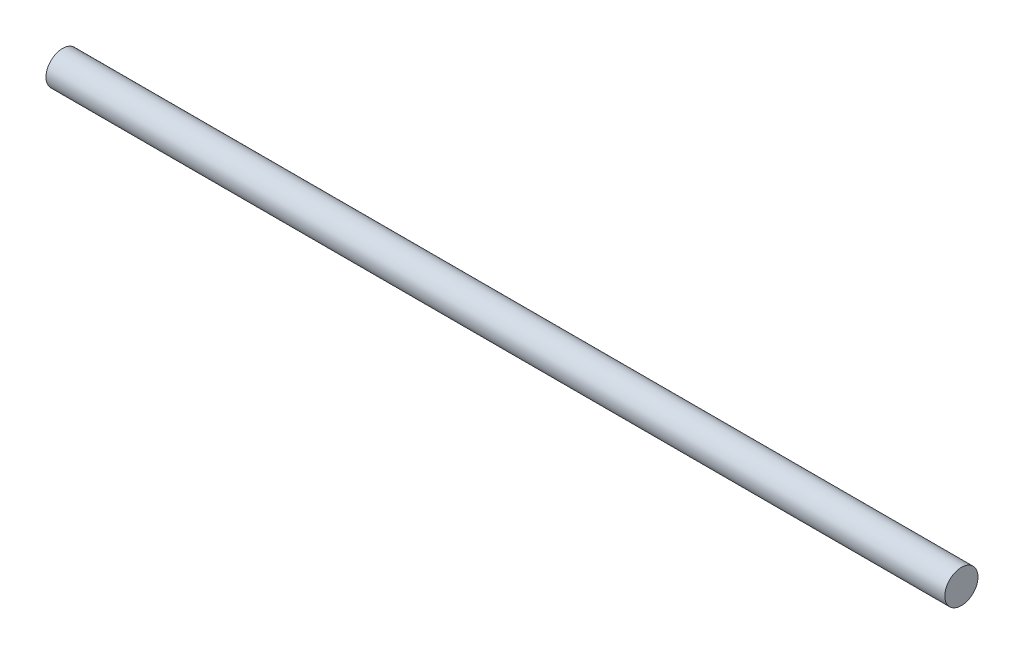
from build123d import *

# Parameters (mm, degrees)
SKETCH1_R  = 10.31875
TREE_DEPTH = 558.8


with BuildPart() as part:
    # Sketch1 → Tree (new body)
    with BuildSketch(Plane(origin=(0, 0, 0), x_dir=(0, 0, -1), z_dir=(1, 0, 0))):
        Circle(SKETCH1_R)
    extrude(amount=TREE_DEPTH)


solid = part.part
